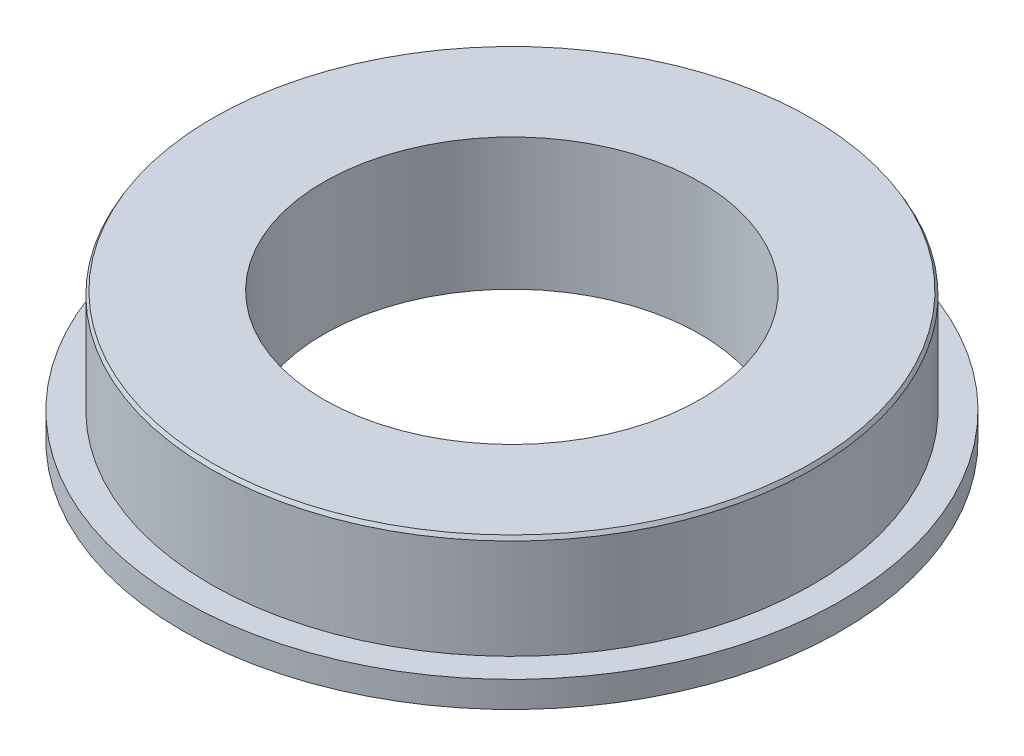
from build123d import *
from OCP.BRepFilletAPI import BRepFilletAPI_MakeChamfer

# Parameters (mm, degrees)
SKETCH_1_R      = 16
SKETCH_1_R_2    = 10
EXTRUDE_1_DEPTH = 7
SKETCH_1_3_R    = 17.5
SKETCH_1_3_R_2  = 16
EXTRUDE_2_DEPTH = 1.5
CHAMFER_1_SIZE  = 0.2
CHAMFER_1_SIZE2 = 0.115470054


with BuildPart() as part:
    # 草图1 → 凸台-拉伸1 (new body)
    with BuildSketch(Plane(origin=(0, 0, 0), x_dir=(1, 0, 0), z_dir=(0, 1, 0))):
        Circle(SKETCH_1_R)
        Circle(SKETCH_1_R_2, mode=Mode.SUBTRACT)
    extrude(amount=EXTRUDE_1_DEPTH)

    # 草图1<3> → 凸台-拉伸2 (add)
    with BuildSketch(Plane(origin=(0, 0, 0), x_dir=(1, 0, 0), z_dir=(0, 1, 0))):
        Circle(SKETCH_1_3_R)
        Circle(SKETCH_1_3_R_2, mode=Mode.SUBTRACT)
    extrude(amount=EXTRUDE_2_DEPTH)

    # 倒角1: one chamfer whose edges measure the first distance from different faces: ONE call of the kernel's chamfer builder (chamfer() names one face for all edges)
    chamfer_1_edges_1 = [part.edges().sort_by_distance(p)[0] for p in [
        (-16, 7, 0),
    ]]
    chamfer_1_side_1 = [part.faces().sort_by_distance(p)[0] for p in [
        (-16, 4.25, 0),
    ]]
    chamfer_1_edges_2 = [part.edges().sort_by_distance(p)[0] for p in [
        (-17.5, 0, 0),
    ]]
    chamfer_1_side_2 = [part.faces().sort_by_distance(p)[0] for p in [
        (-17.005025253, 0, 0),
    ]]
    chamfer_1 = BRepFilletAPI_MakeChamfer(part.part.solid().wrapped)
    for e in chamfer_1_edges_1:
        chamfer_1.Add(CHAMFER_1_SIZE, CHAMFER_1_SIZE2, e.wrapped, chamfer_1_side_1[0].wrapped)  # the first distance lies on this face
    for e in chamfer_1_edges_2:
        chamfer_1.Add(CHAMFER_1_SIZE, CHAMFER_1_SIZE2, e.wrapped, chamfer_1_side_2[0].wrapped)  # the first distance lies on this face
    add(Compound.cast(chamfer_1.Shape()), mode=Mode.REPLACE)


solid = part.part
